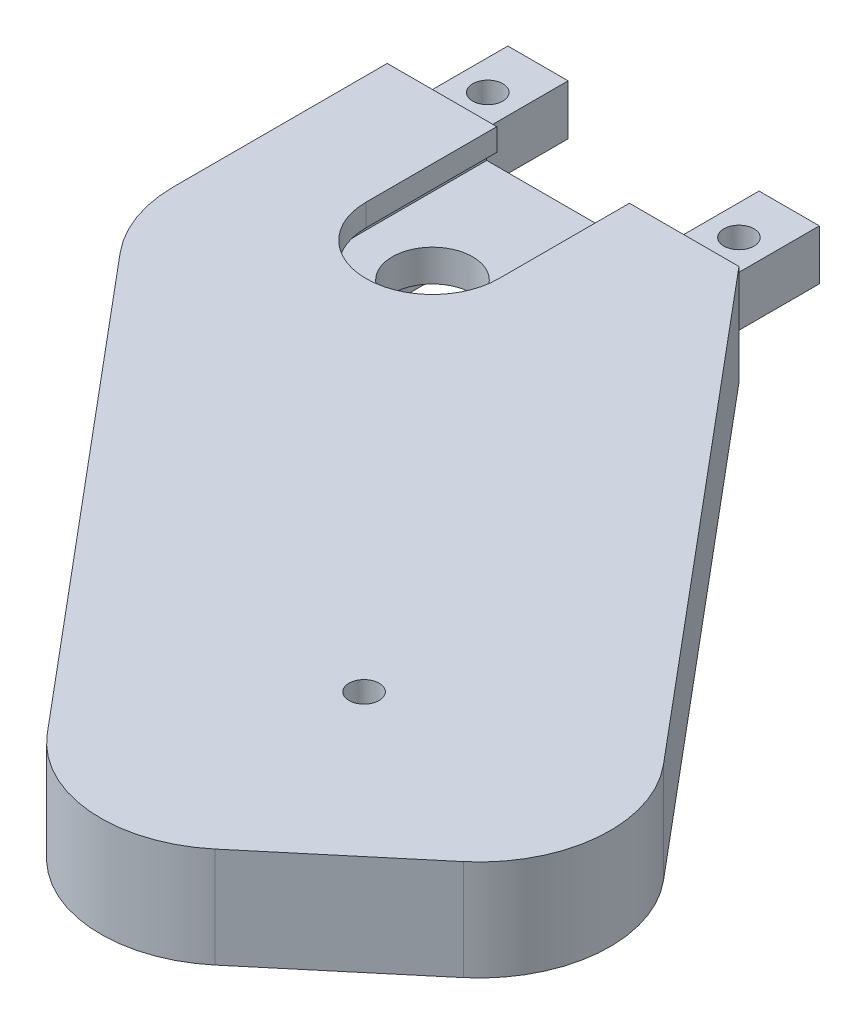
from build123d import *

# Parameters (mm, degrees)
SKETCH10_W          = 35
SKETCH10_H          = 26
BOSS_EXTRUDE4_DEPTH = 2.5
SKETCH1_R           = 1.5
BOSS_EXTRUDE5_DEPTH = 5
SKETCH11_W          = 35
SKETCH11_H          = 26
BOSS_EXTRUDE6_DEPTH = 2.5
CUT_EXTRUDE1_START  = -13
CUT_EXTRUDE1_DEPTH  = 56.676105727
SKETCH4_R           = 7.6
CUT_EXTRUDE2_DEPTH  = 1.2
SKETCH5_R           = 6.6
CUT_EXTRUDE3_DEPTH  = 50.27874954
SKETCH8_R           = 4
CUT_EXTRUDE6_DEPTH  = 50.27874954
SKETCH13_R          = 1.5
BOSS_EXTRUDE7_DEPTH = 10
FILLET1_R           = 13
CUT_EXTRUDE11_DEPTH = 154.613950883
FILLET2_R           = 13


with BuildPart() as part:
    # Sketch10 → Boss-Extrude4 (new body)
    with BuildSketch(Plane(origin=(0, 0, 0), x_dir=(1, 0, 0), z_dir=(0, 1, 0))):
        with Locations((15.5, -23)):
            Rectangle(SKETCH10_W, SKETCH10_H)
    extrude(amount=BOSS_EXTRUDE4_DEPTH)

    # Sketch1 → Boss-Extrude5 (add)
    with BuildSketch(Plane(origin=(0, 0, 0), x_dir=(1, 0, 0), z_dir=(0, 1, 0))):
        Polygon((0, 0), (6, 0), (6, -10), (25, -10), (25, 0), (31, 0), (31, -10), (33, -10), (33, -36), (-2, -36), (-2, -10), (0, -10), align=None)
        with Locations(Location((3, -5, 0), (0, 0, 270))):
            Circle(SKETCH1_R, mode=Mode.SUBTRACT)
        with Locations(Location((28, -5, 0), (0, 0, 90))):
            Circle(SKETCH1_R, mode=Mode.SUBTRACT)
    extrude(amount=-BOSS_EXTRUDE5_DEPTH)

    # Sketch11 → Boss-Extrude6 (add)
    with BuildSketch(Plane.XZ.offset(5)):
        with Locations((15.5, 23)):
            Rectangle(SKETCH11_W, SKETCH11_H)
    extrude(amount=BOSS_EXTRUDE6_DEPTH)

    # Sketch3 → Cut-Extrude1 (cut)
    with BuildSketch(Plane(origin=(0, 0, 10), x_dir=(-1, 0, 0), z_dir=(0, 0, -1)).offset(CUT_EXTRUDE1_START)):
        Polygon((-22.1, 2.5), (-22.1, 0.2875), (-23.1, 0.2875), (-23.1, -0.9125), (-15.5, -0.9125), (-7.9, -0.9125), (-7.9, 0.2875), (-8.9, 0.2875), (-8.9, 2.5), align=None)
    cut_extrude1 = extrude(amount=CUT_EXTRUDE1_DEPTH, mode=Mode.SUBTRACT)

    # Sketch4 → Cut-Extrude2 (cut)
    with BuildSketch(Plane(origin=(0, -0.9125, 0), x_dir=(1, 0, 0), z_dir=(0, 1, 0))):
        with Locations((15.5, -23)):
            Circle(SKETCH4_R)
    cut_extrude2 = extrude(amount=CUT_EXTRUDE2_DEPTH, mode=Mode.SUBTRACT)

    # Sketch5 → Cut-Extrude3 (cut, through all)
    with BuildSketch(Plane(origin=(0, -0.9125, 0), x_dir=(1, 0, 0), z_dir=(0, 1, 0))):
        with Locations((15.5, -23)):
            Circle(SKETCH5_R)
    cut_extrude3 = extrude(amount=CUT_EXTRUDE3_DEPTH, mode=Mode.SUBTRACT)

    # Sketch8 → Cut-Extrude6 (cut, through all)
    with BuildSketch(Plane(origin=(0, -0.9125, 0), x_dir=(1, 0, 0), z_dir=(0, 1, 0))):
        with Locations(Location((15.5, -23, 0), (0, 0, 270))):
            Circle(SKETCH8_R)
    extrude(amount=-CUT_EXTRUDE6_DEPTH, mode=Mode.SUBTRACT)

    # Mirror1: Cut-Extrude1, Cut-Extrude2, Cut-Extrude3 across plane
    add(cut_extrude1.mirror(Plane.ZX.offset(-2.5)), mode=Mode.SUBTRACT)
    add(cut_extrude2.mirror(Plane.ZX.offset(-2.5)), mode=Mode.SUBTRACT)
    add(cut_extrude3.mirror(Plane.ZX.offset(-2.5)), mode=Mode.SUBTRACT)

    # Sketch13 → Boss-Extrude7 (add)
    with BuildSketch(Plane(origin=(0, 2.5, 0), x_dir=(1, 0, 0), z_dir=(0, 1, 0))):
        Polygon((-2, -36), (70.668567607, -122.603026514), (104.009911505, -94.626317146), (33, -10), (33, -36), align=None)
        with Locations(Location((51.004955752, -65.313158573, 0), (0, 0, 270))):
            Circle(SKETCH13_R, mode=Mode.SUBTRACT)
    extrude(amount=-BOSS_EXTRUDE7_DEPTH)

    # Fillet1
    fillet1_edges = [part.edges().sort_by_distance(p)[0] for p in [
        (104.009911505, -2.5, 94.626317146),
        (70.668567607, -2.5, 122.603026514),
        (-2, -2.5, 36),
    ]]
    fillet(fillet1_edges, radius=FILLET1_R)

    # Sketch18 → Cut-Extrude11 (cut, through all)
    with BuildSketch(Plane(origin=(0, 2.5, 0), x_dir=(1, 0, 0), z_dir=(0, 1, 0))):
        with BuildLine():
            Line((47.190035997, -94.622402119), (80.531379895, -66.645692751))
            Line((80.531379895, -66.645692751), (95.653672579, -84.667739385))
            ThreePointArc((95.653672579, -84.667739385), (98.645625894, -94.157002967), (94.051333744, -102.982556072))
            Line((94.051333744, -102.982556072), (80.627145367, -114.246787588))
            ThreePointArc((80.627145367, -114.246787588), (71.137881786, -117.238740903), (62.312328681, -112.644448753))
            Line((62.312328681, -112.644448753), (47.190035997, -94.622402119))
        make_face()
    extrude(amount=-CUT_EXTRUDE11_DEPTH, mode=Mode.SUBTRACT)

    # Fillet2
    fillet2_edges = [part.edges().sort_by_distance(p)[0] for p in [
        (47.190035997, -2.5, 94.622402119),
        (80.531379895, -2.5, 66.645692751),
    ]]
    fillet(fillet2_edges, radius=FILLET2_R)


solid = part.part
